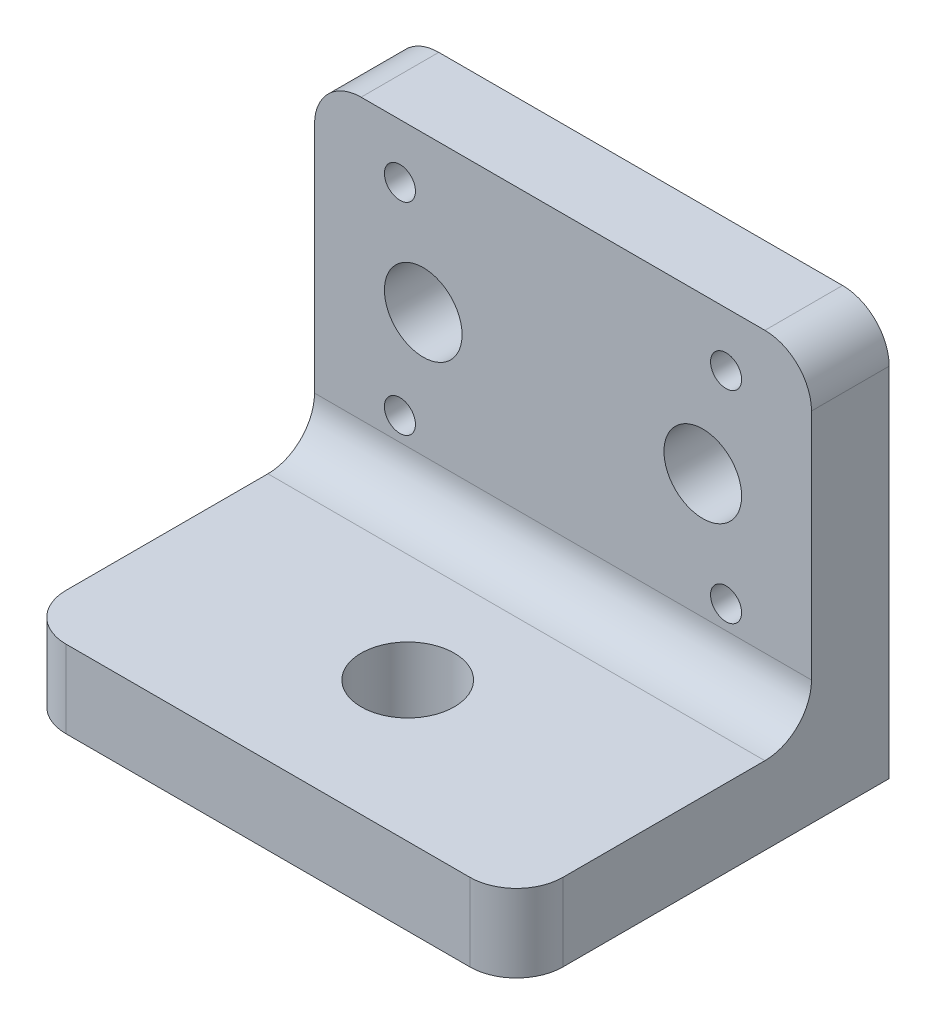
from build123d import *

# Parameters (mm, degrees)
SKETCH1_W             = 32
SKETCH1_H             = 32
BOSS_EXTRUDE1_DEPTH   = 5
F_5_0MM_DOWEL_HOLE1_D = 5
F_2_0MM_DOWEL_HOLE1_D = 2
SKETCH11_W            = 32
SKETCH11_H            = 5
BOSS_EXTRUDE3_DEPTH   = 19
F_6_0MM_DOWEL_HOLE1_D = 6
SKETCH14_W            = 32
SKETCH14_H            = 5
CUT_EXTRUDE1_DEPTH    = 6
FILLET3_R             = 3


with BuildPart() as part:
    # Sketch1 → Boss-Extrude1 (new body)
    with BuildSketch(Plane.XY):
        Rectangle(SKETCH1_W, SKETCH1_H)
    extrude(amount=BOSS_EXTRUDE1_DEPTH)

    # Ø5.0mm Dowel Hole1 (through all)
    with Locations(Plane.XY.offset(5)):
        with Locations((-9, 0), (9, 0)):
            Hole(F_5_0MM_DOWEL_HOLE1_D / 2)

    # Ø2.0mm Dowel Hole1 (through all)
    with Locations(Plane.XY.offset(5)):
        with Locations((-10.5, 6.5), (10.5, 6.5), (10.5, -6.5), (-10.5, -6.5)):
            Hole(F_2_0MM_DOWEL_HOLE1_D / 2)

    # Sketch11 → Boss-Extrude3 (add)
    with BuildSketch(Plane.XY.offset(5)):
        with Locations((0, -13.5)):
            Rectangle(SKETCH11_W, SKETCH11_H)
    extrude(amount=BOSS_EXTRUDE3_DEPTH)

    # Ø6.0mm Dowel Hole1 (through all)
    with Locations(Plane(origin=(0, -11, 0), x_dir=(1, 0, 0), z_dir=(0, 1, 0))):
        with Locations((0, -15)):
            Hole(F_6_0MM_DOWEL_HOLE1_D / 2)

    # Sketch14 → Cut-Extrude1 (cut)
    with BuildSketch(Plane(origin=(0, 16, 0), x_dir=(1, 0, 0), z_dir=(0, 1, 0))):
        with Locations((0, -2.5)):
            Rectangle(SKETCH14_W, SKETCH14_H)
    extrude(amount=-CUT_EXTRUDE1_DEPTH, mode=Mode.SUBTRACT)

    # Fillet3
    fillet3_edges = [part.edges().sort_by_distance(p)[0] for p in [
        (0, -11, 5),
        (-16, -13.5, 24),
        (16, -13.5, 24),
        (16, 10, 2.5),
        (-16, 10, 2.5),
    ]]
    fillet(fillet3_edges, radius=FILLET3_R)


solid = part.part
